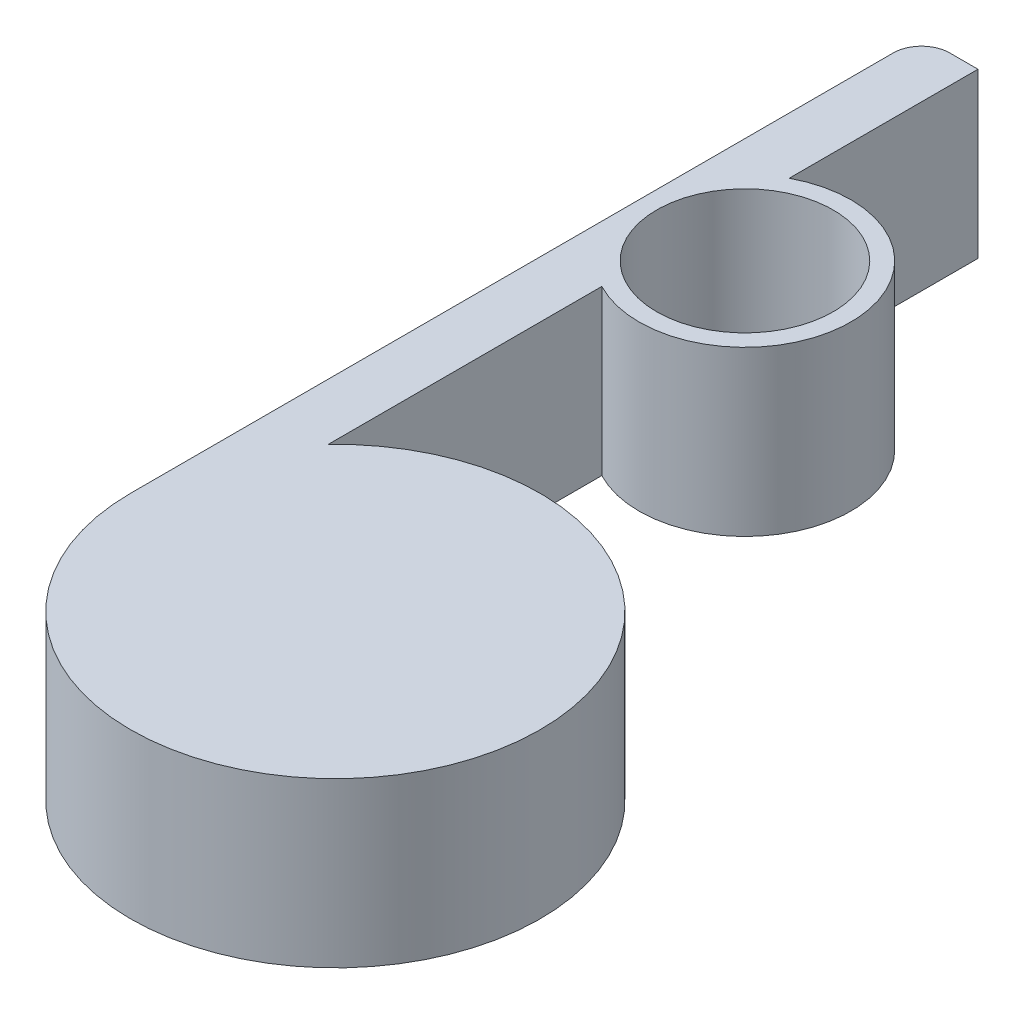
from build123d import *

# Parameters (mm, degrees)
SKETCH1_R           = 3.125
BOSS_EXTRUDE1_DEPTH = 5.8
FILLET1_R           = 1


with BuildPart() as part:
    # Sketch1 → Boss-Extrude1 (new body)
    with BuildSketch(Plane(origin=(0, 0, 0), x_dir=(1, 0, 0), z_dir=(0, 1, 0))):
        with BuildLine():
            Line((-1.75, 10), (-3.75, 10))
            Line((-3.75, 10), (-3.75, -18))
            ThreePointArc((-3.75, -18), (9.742495495, -21.686970301), (0, -11.65078745))
            ThreePointArc((0, -11.65078745), (-0.926705166, -12.258329392), (-1.75, -13))
            Line((-1.75, -13), (-1.75, -3.31662479))
            ThreePointArc((-1.75, -3.31662479), (-0.901431372, -3.640044159), (0, -3.75))
            ThreePointArc((0, -3.75), (3.640044159, 0.901431372), (-1.75, 3.31662479))
            Line((-1.75, 3.31662479), (-1.75, 10))
        make_face()
        with Locations(Location((0, 0, 0), (0, 0, 270))):
            Circle(SKETCH1_R, mode=Mode.SUBTRACT)
    extrude(amount=BOSS_EXTRUDE1_DEPTH)

    # Fillet1
    fillet1_edges = [part.edges().sort_by_distance(p)[0] for p in [
        (-3.75, 2.9, -10),
    ]]
    fillet(fillet1_edges, radius=FILLET1_R)


solid = part.part
